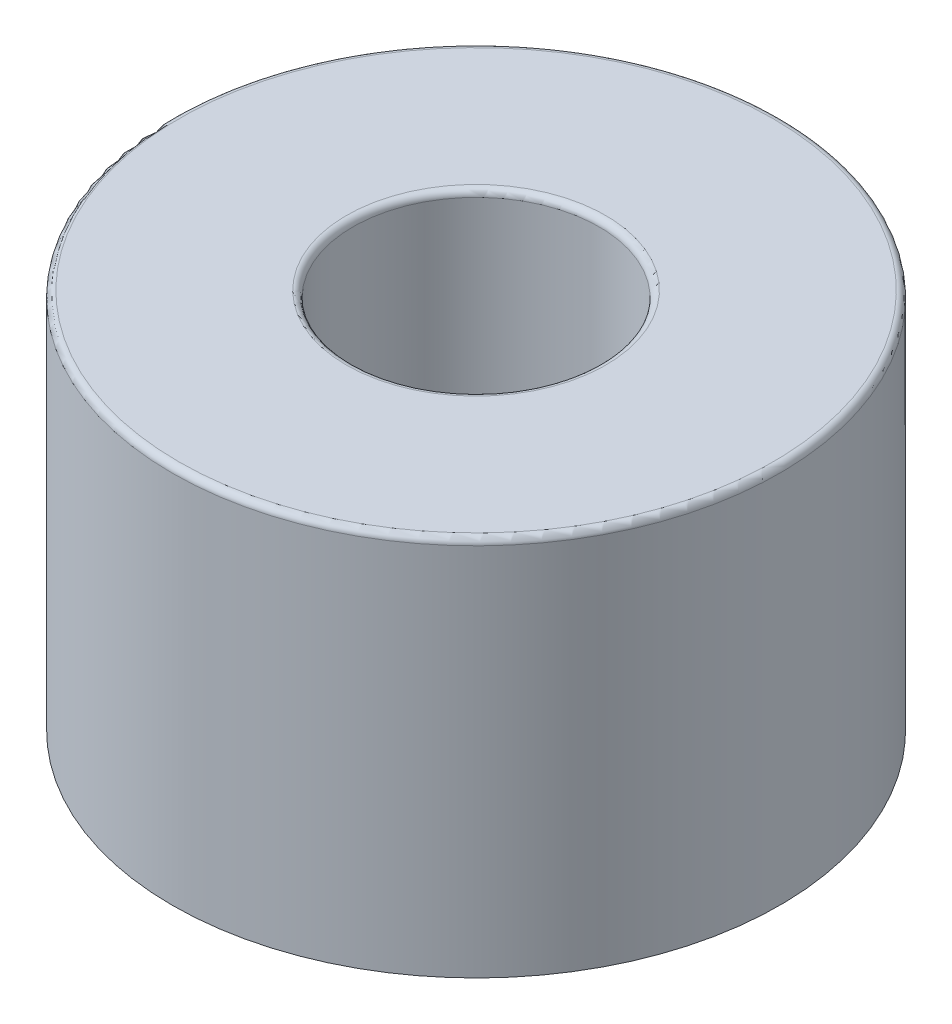
from build123d import *

# Parameters (mm, degrees)
SKETCH1_R           = 11.75
SKETCH1_R_2         = 4.7625
BOSS_EXTRUDE1_DEPTH = 14.732
FILLET1_R           = 0.254


with BuildPart() as part:
    # Sketch1 → Boss-Extrude1 (new body)
    with BuildSketch(Plane(origin=(0, 0, 0), x_dir=(1, 0, 0), z_dir=(0, 1, 0))):
        with Locations(Location((0, 0, 0), (0, 0, 270))):
            Circle(SKETCH1_R)
        with Locations(Location((0, 0, 0), (0, 0, 270))):
            Circle(SKETCH1_R_2, mode=Mode.SUBTRACT)
    extrude(amount=BOSS_EXTRUDE1_DEPTH)

    # Fillet1
    fillet1_edges = [part.edges().sort_by_distance(p)[0] for p in [
        (0, 14.732, -11.75),
        (0, 14.732, -4.7625),
    ]]
    fillet(fillet1_edges, radius=FILLET1_R)


solid = part.part
